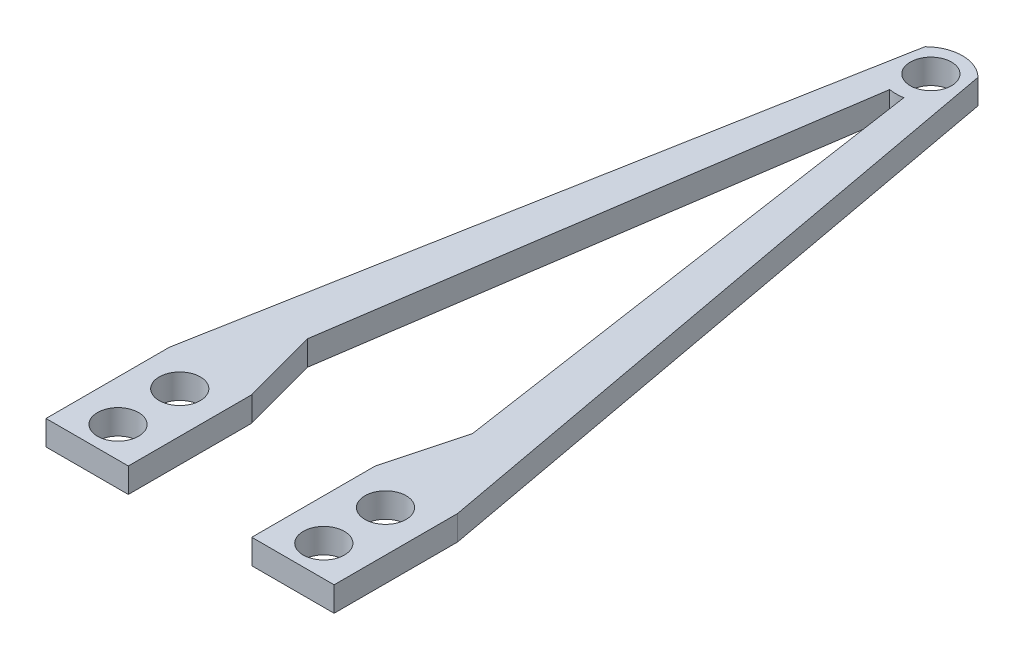
from build123d import *

# Parameters (mm, degrees)
SKETCH1_R           = 5
BOSS_EXTRUDE1_DEPTH = 6
CUT_EXTRUDE1_DEPTH  = 10


with BuildPart() as part:
    # Sketch1 → Boss-Extrude1 (new body)
    with BuildSketch(Plane(origin=(0, 0, 0), x_dir=(1, 0, 0), z_dir=(0, 1, 0))):
        with BuildLine():
            Line((-35, -15), (35, -15))
            Line((35, -15), (35, 15))
            Line((35, 15), (6.447368421, 170))
            ThreePointArc((6.447368421, 170), (0, 172.670587442), (-6.447368421, 170))
            Line((-6.447368421, 170), (-35, 15))
            Line((-35, 15), (-35, -15))
        make_face()
        with Locations(Location((0, 165, 0), (0, 0, 270))):
            Circle(SKETCH1_R, mode=Mode.SUBTRACT)
        with Locations(Location((-25, 7.5, 0), (0, 0, 270))):
            Circle(SKETCH1_R, mode=Mode.SUBTRACT)
        with Locations(Location((-25, -7.5, 0), (0, 0, 270))):
            Circle(SKETCH1_R, mode=Mode.SUBTRACT)
        with Locations(Location((25, 7.5, 0), (0, 0, 90))):
            Circle(SKETCH1_R, mode=Mode.SUBTRACT)
        with Locations(Location((25, -7.5, 0), (0, 0, 90))):
            Circle(SKETCH1_R, mode=Mode.SUBTRACT)
    extrude(amount=BOSS_EXTRUDE1_DEPTH)

    # Sketch6 → Cut-Extrude1 (cut)
    with BuildSketch(Plane(origin=(0, 6, 0), x_dir=(1, 0, 0), z_dir=(0, 1, 0))):
        with BuildLine():
            Line((-15, -15), (-15, 15))
            Line((-15, 15), (-20, 33.595074374))
            Line((-20, 33.595074374), (-1.721816463, 156.693521977))
            ThreePointArc((-1.721816463, 156.693521977), (0, 156.566387575), (1.721816463, 156.693521977))
            Line((1.721816463, 156.693521977), (20, 33.595074374))
            Line((20, 33.595074374), (15, 15))
            Line((15, 15), (15, -15))
            Line((15, -15), (-15, -15))
        make_face()
    extrude(amount=-CUT_EXTRUDE1_DEPTH, mode=Mode.SUBTRACT)


solid = part.part
